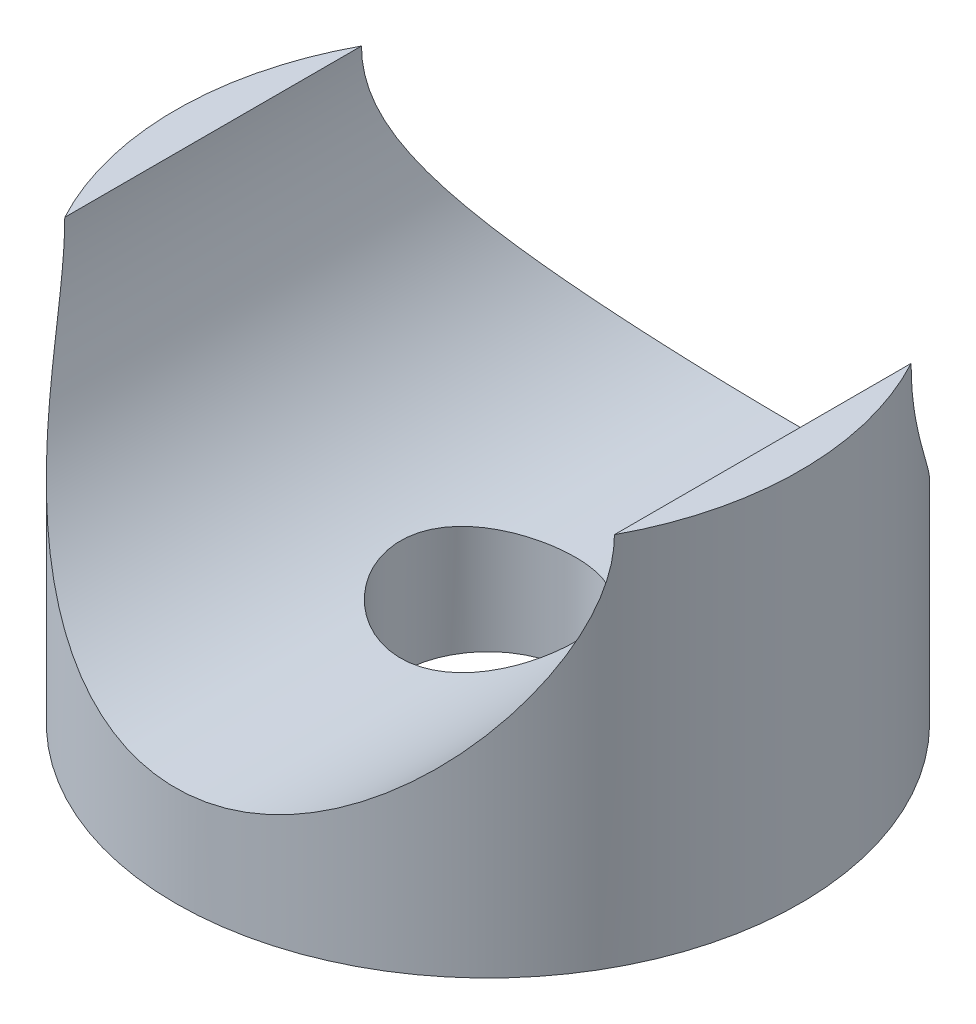
from build123d import *

# Parameters (mm, degrees)
SKETCH1_R               = 12.5
SKETCH1_R_2             = 3.5
BOSS_EXTRUDE1_DEPTH     = 15
CUT_EXTRUDE1_DEPTH      = 22
CUT_EXTRUDE1_DEPTH_BACK = 22
SKETCH2_R               = 11


with BuildPart() as part:
    # Sketch1 → Boss-Extrude1 (new body)
    with BuildSketch(Plane(origin=(0, 0, 0), x_dir=(1, 0, 0), z_dir=(0, 1, 0))):
        Circle(SKETCH1_R)
        Circle(SKETCH1_R_2, mode=Mode.SUBTRACT)
    extrude(amount=BOSS_EXTRUDE1_DEPTH)

    # Sketch2 → Cut-Extrude1 (cut, two sides: drawn at the far end of the back side and taken through both)
    with BuildSketch(Plane.XY.offset(-CUT_EXTRUDE1_DEPTH_BACK)):
        with Locations((0, 15)):
            Circle(SKETCH2_R)
    extrude(amount=CUT_EXTRUDE1_DEPTH + CUT_EXTRUDE1_DEPTH_BACK, mode=Mode.SUBTRACT)


solid = part.part
